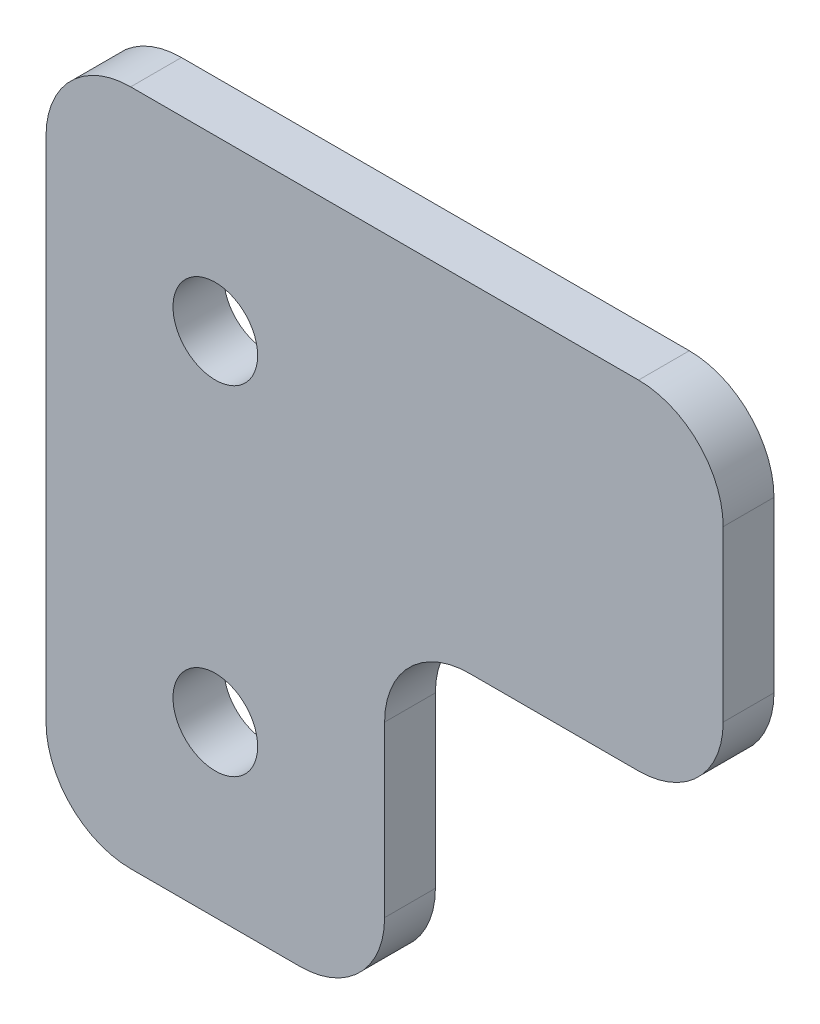
from build123d import *

# Parameters (mm, degrees)
SKETCH_2_R      = 2.5
EXTRUDE_1_DEPTH = 3
FILLET_1_R      = 5


with BuildPart() as part:
    # ｽｹｯﾁ2 → ﾎﾞｽ - 押し出し1 (new body)
    with BuildSketch(Plane.XY):
        Polygon((10, 30), (30, 30), (30, 10), (10, 10), (10, -10), (-10, -10), (-10, 30), align=None)
        Circle(SKETCH_2_R, mode=Mode.SUBTRACT)
        with Locations((0, 20)):
            Circle(SKETCH_2_R, mode=Mode.SUBTRACT)
    extrude(amount=EXTRUDE_1_DEPTH)

    # ﾌｨﾚｯﾄ1
    fillet_1_edges = [part.edges().sort_by_distance(p)[0] for p in [
        (-10, 30, 1.5),
        (30, 30, 1.5),
        (30, 10, 1.5),
        (10, 10, 1.5),
        (10, -10, 1.5),
        (-10, -10, 1.5),
    ]]
    fillet(fillet_1_edges, radius=FILLET_1_R)


solid = part.part
